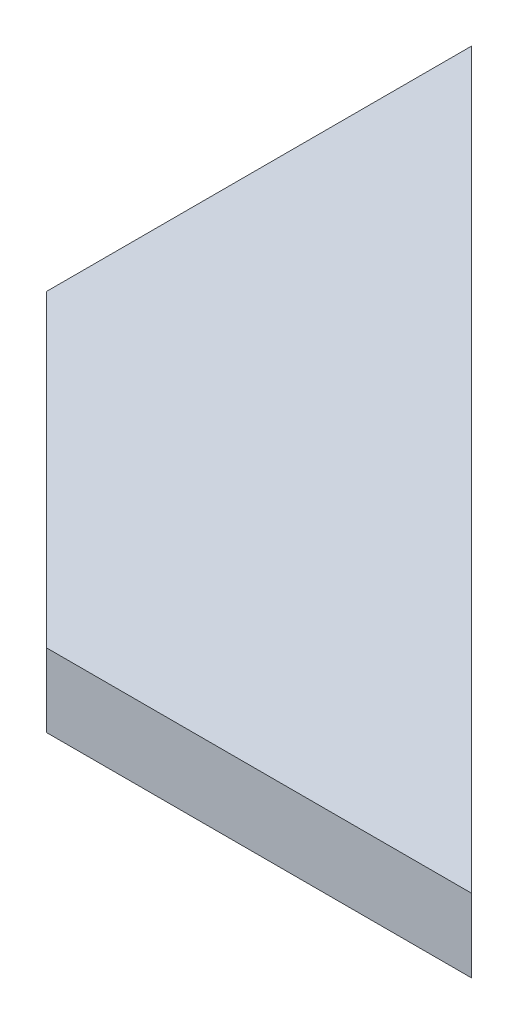
from build123d import *

# Parameters (mm, degrees)
BOSS_EXTRUDE1_DEPTH = 10


with BuildPart() as part:
    # Sketch1 → Boss-Extrude1 (new, symmetric)
    with BuildSketch(Plane(origin=(0, 0, 0), x_dir=(1, 0, 0), z_dir=(0, 1, 0))):
        Polygon((0, 84.082156952), (84.082156952, 0), (200, 0), (0, 200), align=None)
    extrude(amount=BOSS_EXTRUDE1_DEPTH, both=True)


solid = part.part
